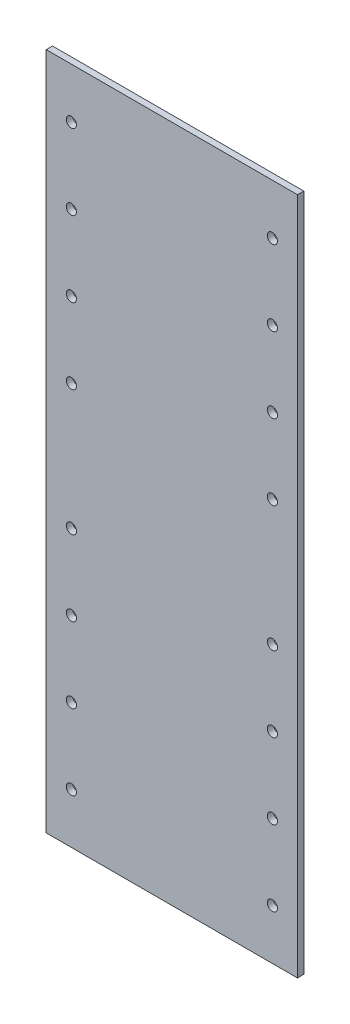
from build123d import *

# Parameters (mm, degrees)
SKETCH1_W           = 127
SKETCH1_H           = 342.9
BOSS_EXTRUDE1_DEPTH = 3.175
SKETCH2_R           = 2.5796875
CUT_EXTRUDE1_DEPTH  = 3.175


with BuildPart() as part:
    # Sketch1 → Boss-Extrude1 (new body)
    with BuildSketch(Plane.XY):
        Rectangle(SKETCH1_W, SKETCH1_H)
    extrude(amount=BOSS_EXTRUDE1_DEPTH)

    # Sketch2 → Cut-Extrude1 (cut)
    with BuildSketch(Plane.XY.offset(3.175)):
        with Locations((-50.8, -146.05)):
            Circle(SKETCH2_R)
        with Locations((-50.8, -107.95)):
            Circle(SKETCH2_R)
        with Locations((-50.8, -69.85)):
            Circle(SKETCH2_R)
        with Locations((-50.8, 69.85)):
            Circle(SKETCH2_R)
        with Locations((-50.8, 107.95)):
            Circle(SKETCH2_R)
        with Locations((-50.8, 146.05)):
            Circle(SKETCH2_R)
        with Locations((-50.8, 31.75)):
            Circle(SKETCH2_R)
        with Locations((-50.8, -31.75)):
            Circle(SKETCH2_R)
    cut_extrude1 = extrude(amount=-CUT_EXTRUDE1_DEPTH, mode=Mode.SUBTRACT)

    # Mirror1: Cut-Extrude1 across plane
    add(cut_extrude1.mirror(Plane(origin=(0, 0, 0), x_dir=(0, 0, 1), z_dir=(1, 0, 0))), mode=Mode.SUBTRACT)


solid = part.part
